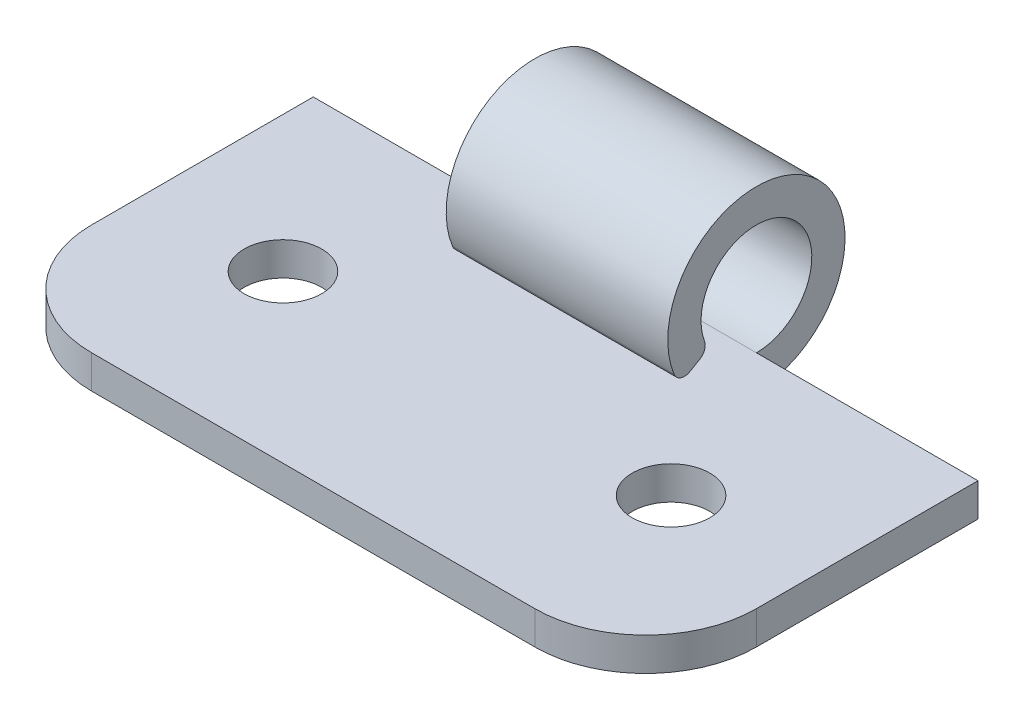
from build123d import *

# Parameters (mm, degrees)
SKETCH_1_W      = 30
SKETCH_1_H      = 15
SKETCH_1_R      = 1.75
EXTRUDE_1_DEPTH = 1.5
FILLET_1_R      = 5
EXTRUDE_3_DEPTH = 5


with BuildPart() as part:
    # 草图1 → 凸台-拉伸1 (new body)
    with BuildSketch(Plane(origin=(0, 0, 0), x_dir=(1, 0, 0), z_dir=(0, 1, 0))):
        Rectangle(SKETCH_1_W, SKETCH_1_H)
        with Locations(Location((-8.867330988, 0, 0), (0, 0, 270))):
            Circle(SKETCH_1_R, mode=Mode.SUBTRACT)
        with Locations(Location((8.647397187, 0, 0), (0, 0, 270))):
            Circle(SKETCH_1_R, mode=Mode.SUBTRACT)
    extrude(amount=EXTRUDE_1_DEPTH)

    # 圆角1
    fillet_1_edges = [part.edges().sort_by_distance(p)[0] for p in [
        (15, 0.75, 7.5),
        (-15, 0.75, 7.5),
    ]]
    fillet(fillet_1_edges, radius=FILLET_1_R)

    # 草图2 → 凸台-拉伸3 (add, symmetric)
    with BuildSketch(Plane(origin=(0, 0, 0), x_dir=(0, 0, -1), z_dir=(1, 0, 0))):
        with BuildLine():
            Line((4.938262309, 2.520980054), (4.5, 2.267949192))
            ThreePointArc((4.5, 2.267949192), (4.086336582, 2.228506303), (3.785714286, 2.515385022))
            ThreePointArc((3.785714286, 2.515385022), (9.742937815, 7.311982783), (7.5, 0))
            Line((7.5, 0), (7.5, 1.5))
            ThreePointArc((7.5, 1.5), (8.926677651, 6.052946877), (5.156885257, 3.128327297))
            ThreePointArc((5.156885257, 3.128327297), (5.15871146, 2.784648148), (4.938262309, 2.520980054))
        make_face()
    extrude(amount=EXTRUDE_3_DEPTH, both=True)


solid = part.part
